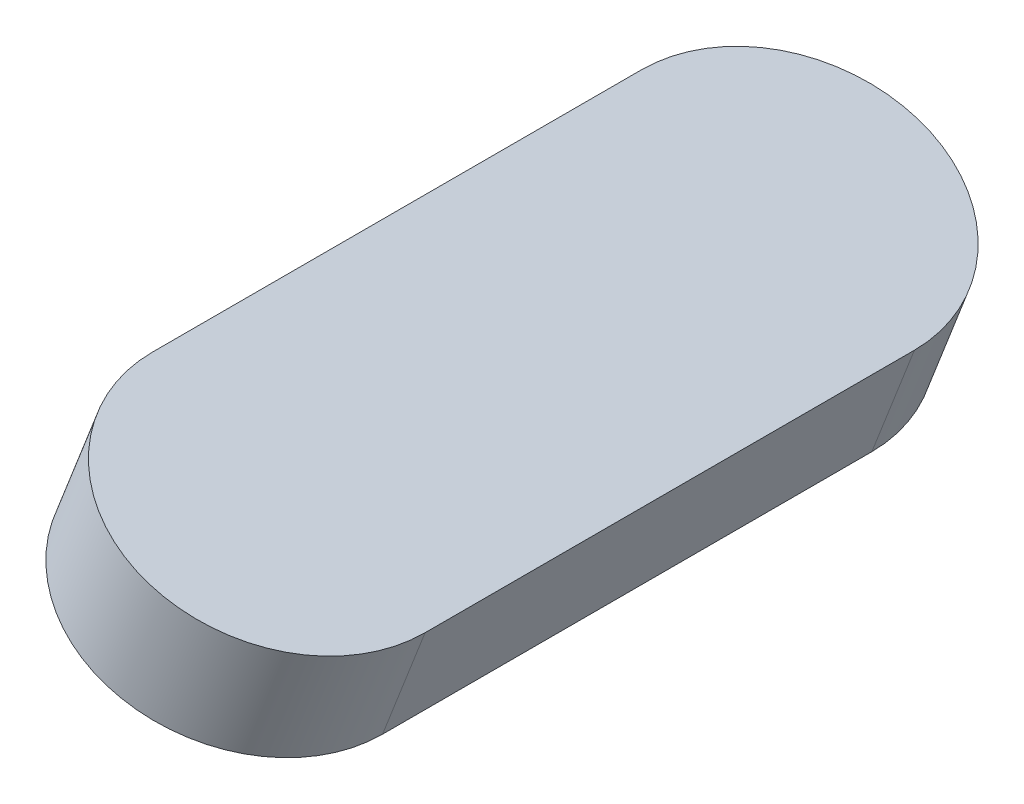
from build123d import *

# Parameters (mm, degrees)
BOSS_EXTRUDE1_DEPTH = 2.54


with BuildPart() as part:
    # Sketch1 → Boss-Extrude1 (new body)
    with BuildSketch(Plane(origin=(-4.89903509, -12.573036438, 0), x_dir=(0.9317661243126444, -0.3630590717547129, 0), z_dir=(0.36305907175471297, 0.9317661243126445, 0))):
        with BuildLine():
            Line((1.801681512, -37.365601905), (1.801681512, -26.759740984))
            ThreePointArc((1.801681512, -26.759740984), (-1.373318488, -23.584740984), (-4.548318488, -26.759740984))
            Line((-4.548318488, -26.759740984), (-4.548318488, -37.365601905))
            ThreePointArc((-4.548318488, -37.365601905), (-1.373318488, -40.540601905), (1.801681512, -37.365601905))
        make_face()
    extrude(amount=BOSS_EXTRUDE1_DEPTH)


solid = part.part
